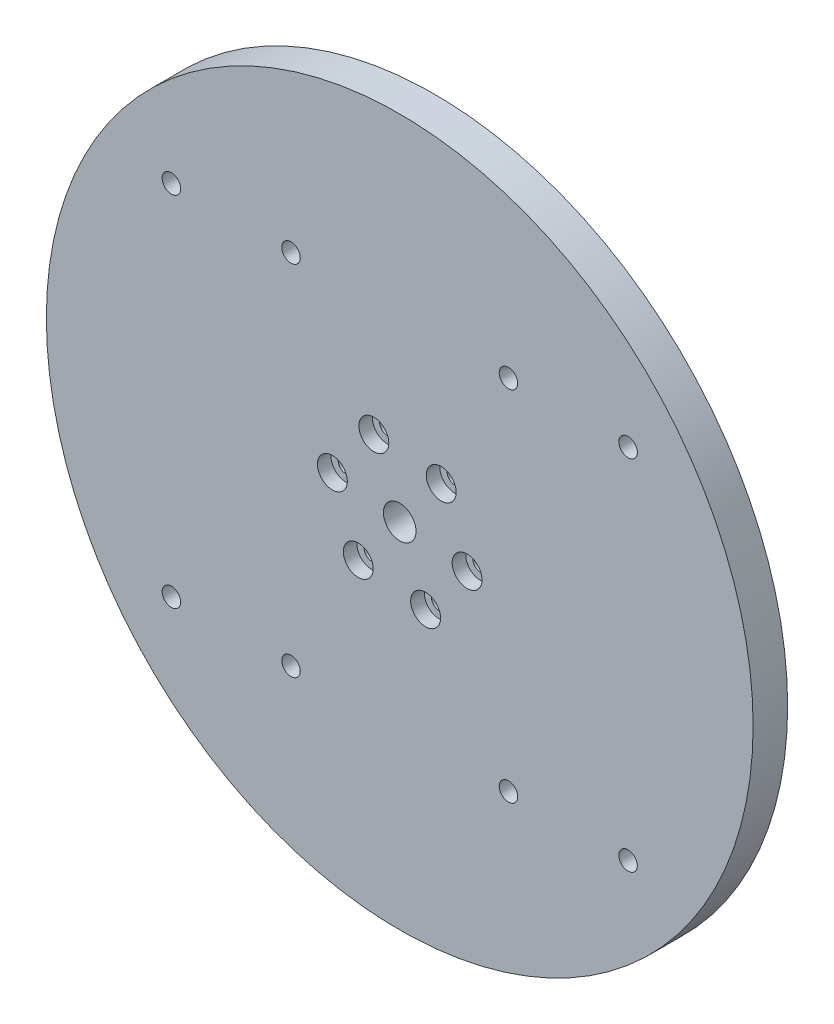
from build123d import *

# Parameters (mm, degrees)
DISCO_START                         = 70
SK_DISCO_R                          = 65
DISCO_DEPTH                         = 6.35
CENTRADOR_ARANDELA_EJE_51110_START  = 67
SK_CENTRADOR_ARANDELA_EJE_51110_R   = 24.9
SK_CENTRADOR_ARANDELA_EJE_51110_R_2 = 23
CENTRADOR_ARANDELA_EJE_51110_DEPTH  = 3
PASANTES_M2_5_ROTOR_J1_START        = 70
SK_PASANTES_M2_5_ROTOR_J1_R         = 1.45
PASANTES_M2_5_ROTOR_J1_DEPTH        = 6.35
CAJAS_M2_5_START                    = 73.85
SK_CAJAS_M2_5_R                     = 2.75
CAJAS_M2_5_DEPTH                    = 2.5
PASO_CABLE_START                    = 70
SK_PASO_CABLE_R                     = 3
PASO_CABLE_DEPTH                    = 6.35
SK_PASANTES_M3_PAREDES_R            = 1.7
PASANTES_M3_PAREDES_DEPTH           = 93.398173683
SK_CAJAS_M3_PAREDES_R               = 3.25
CAJAS_M3_PAREDES_DEPTH              = 3.5


with BuildPart() as part:
    # Sk_Disco → Disco (new body)
    with BuildSketch(Plane.XY.offset(DISCO_START)):
        Circle(SK_DISCO_R)
    extrude(amount=DISCO_DEPTH)

    # Sk_Centrador_arandela_eje_51110 → Centrador_arandela_eje_51110 (add)
    with BuildSketch(Plane.XY.offset(CENTRADOR_ARANDELA_EJE_51110_START)):
        Circle(SK_CENTRADOR_ARANDELA_EJE_51110_R)
        Circle(SK_CENTRADOR_ARANDELA_EJE_51110_R_2, mode=Mode.SUBTRACT)
    extrude(amount=CENTRADOR_ARANDELA_EJE_51110_DEPTH)

    # Sk_Pasantes_M2-5_rotor_J1 → Pasantes_M2-5_rotor_J1 (cut)
    with BuildSketch(Plane.XY.offset(PASANTES_M2_5_ROTOR_J1_START)):
        with Locations((12.390194253, -1.653204878)):
            Circle(SK_PASANTES_M2_5_ROTOR_J1_R)
        with Locations((7.626814549, 9.903620542)):
            Circle(SK_PASANTES_M2_5_ROTOR_J1_R)
        with Locations((-4.763379704, 11.55682542)):
            Circle(SK_PASANTES_M2_5_ROTOR_J1_R)
        with Locations((-12.390194253, 1.653204878)):
            Circle(SK_PASANTES_M2_5_ROTOR_J1_R)
        with Locations((-7.626814549, -9.903620542)):
            Circle(SK_PASANTES_M2_5_ROTOR_J1_R)
        with Locations((4.763379704, -11.55682542)):
            Circle(SK_PASANTES_M2_5_ROTOR_J1_R)
    extrude(amount=PASANTES_M2_5_ROTOR_J1_DEPTH, mode=Mode.SUBTRACT)

    # Sk_Cajas_M2-5 → Cajas_M2-5 (cut)
    with BuildSketch(Plane.XY.offset(CAJAS_M2_5_START)):
        with Locations((12.390194253, -1.653204878)):
            Circle(SK_CAJAS_M2_5_R)
        with Locations((7.626814549, 9.903620542)):
            Circle(SK_CAJAS_M2_5_R)
        with Locations((-4.763379704, 11.55682542)):
            Circle(SK_CAJAS_M2_5_R)
        with Locations((-12.390194253, 1.653204878)):
            Circle(SK_CAJAS_M2_5_R)
        with Locations((-7.626814549, -9.903620542)):
            Circle(SK_CAJAS_M2_5_R)
        with Locations((4.763379704, -11.55682542)):
            Circle(SK_CAJAS_M2_5_R)
    extrude(amount=CAJAS_M2_5_DEPTH, mode=Mode.SUBTRACT)

    # Sk_Paso_cable → Paso_cable (cut)
    with BuildSketch(Plane.XY.offset(PASO_CABLE_START)):
        Circle(SK_PASO_CABLE_R)
    extrude(amount=PASO_CABLE_DEPTH, mode=Mode.SUBTRACT)

    # Sk_Pasantes_M3_paredes → Pasantes_M3_paredes (cut, through all)
    with BuildSketch(Plane.XY.offset(76.35)):
        with Locations((-42, -32.925)):
            Circle(SK_PASANTES_M3_PAREDES_R)
        with Locations((-20, -32.925)):
            Circle(SK_PASANTES_M3_PAREDES_R)
        with Locations((20, -32.925)):
            Circle(SK_PASANTES_M3_PAREDES_R)
        with Locations((42, -32.925)):
            Circle(SK_PASANTES_M3_PAREDES_R)
        with Locations((-42, 32.925)):
            Circle(SK_PASANTES_M3_PAREDES_R)
        with Locations((-20, 32.925)):
            Circle(SK_PASANTES_M3_PAREDES_R)
        with Locations((20, 32.925)):
            Circle(SK_PASANTES_M3_PAREDES_R)
        with Locations((42, 32.925)):
            Circle(SK_PASANTES_M3_PAREDES_R)
    extrude(amount=-PASANTES_M3_PAREDES_DEPTH, mode=Mode.SUBTRACT)

    # Sk_Cajas_M3_paredes → Cajas_M3_paredes (cut)
    with BuildSketch(Plane(origin=(0, 0, 70), x_dir=(-1, 0, 0), z_dir=(0, 0, -1))):
        with Locations((42, -32.925)):
            Circle(SK_CAJAS_M3_PAREDES_R)
        with Locations((20, -32.925)):
            Circle(SK_CAJAS_M3_PAREDES_R)
        with Locations((-20, -32.925)):
            Circle(SK_CAJAS_M3_PAREDES_R)
        with Locations((-42, -32.925)):
            Circle(SK_CAJAS_M3_PAREDES_R)
        with Locations((42, 32.925)):
            Circle(SK_CAJAS_M3_PAREDES_R)
        with Locations((20, 32.925)):
            Circle(SK_CAJAS_M3_PAREDES_R)
        with Locations((-20, 32.925)):
            Circle(SK_CAJAS_M3_PAREDES_R)
        with Locations((-42, 32.925)):
            Circle(SK_CAJAS_M3_PAREDES_R)
    extrude(amount=-CAJAS_M3_PAREDES_DEPTH, mode=Mode.SUBTRACT)


solid = part.part
